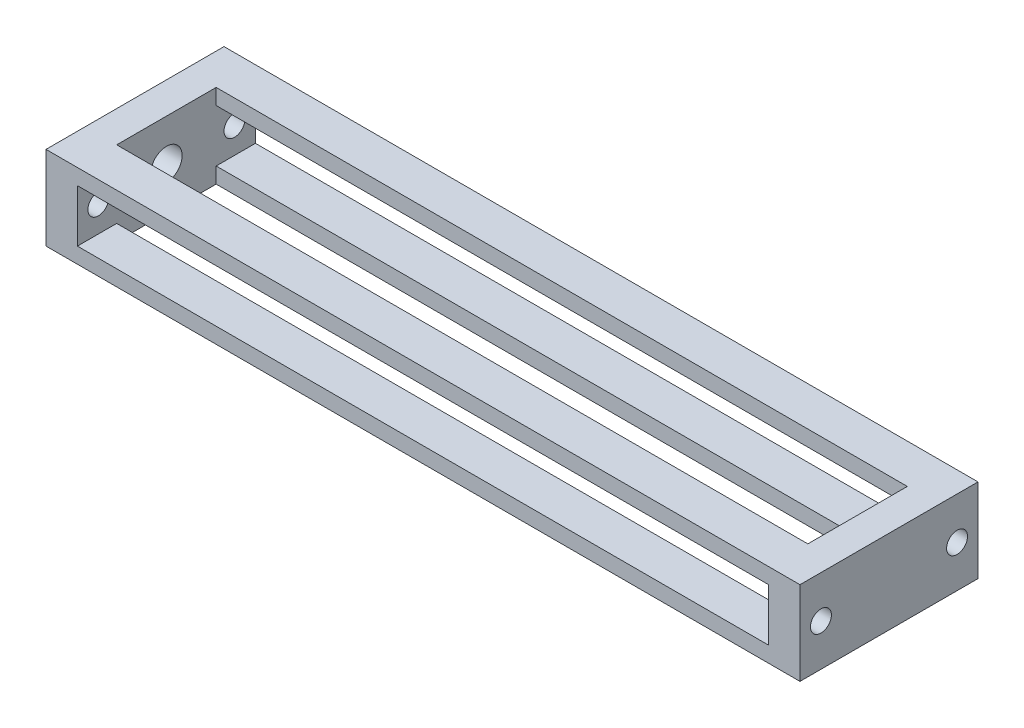
from build123d import *

# Parameters (mm, degrees)
SKETCH1_W               = 914.4
SKETCH1_H               = 215.9
BOSS_EXTRUDE1_DEPTH     = 101.6
CUT_EXTRUDE1_REACH      = 482.633
SKETCH2_W               = 838.2
SKETCH2_H               = 120.65
CUT_EXTRUDE2_DEPTH      = 516.720088808
CUT_EXTRUDE2_DEPTH_BACK = 516.720088808
SKETCH3_W               = 838.2
SKETCH3_H               = 63.5
CUT_EXTRUDE3_DEPTH      = 927.33855717
CUT_EXTRUDE3_DEPTH_BACK = 927.33855717
SKETCH4_R               = 12.7
CUT_EXTRUDE4_REACH      = 928.339
SKETCH5_R               = 19.05


with BuildPart() as part:
    # Sketch1 → Boss-Extrude1 (new body)
    with BuildSketch(Plane(origin=(0, 0, 0), x_dir=(1, 0, 0), z_dir=(0, 1, 0))):
        Rectangle(SKETCH1_W, SKETCH1_H)
    extrude(amount=BOSS_EXTRUDE1_DEPTH)

    # Sketch2 → Cut-Extrude1 (cut, up to next)
    with BuildSketch(Plane(origin=(0, 101.6, 0), x_dir=(1, 0, 0), z_dir=(0, 1, 0)), mode=Mode.PRIVATE) as cut_extrude1_sk1:
        Rectangle(SKETCH2_W, SKETCH2_H)
    cut_extrude1_tool1 = extrude(cut_extrude1_sk1.sketch, amount=-CUT_EXTRUDE1_REACH, mode=Mode.PRIVATE) & part.part
    add(cut_extrude1_tool1.solids().sort_by_distance((0, 101.6, 0))[0], mode=Mode.SUBTRACT)

    # Sketch3 → Cut-Extrude2 (cut, two sides: drawn at the far end of the back side and taken through both)
    with BuildSketch(Plane.XY.offset(107.95).offset(-CUT_EXTRUDE2_DEPTH_BACK)):
        with Locations((0, 50.8)):
            Rectangle(SKETCH3_W, SKETCH3_H)
    extrude(amount=CUT_EXTRUDE2_DEPTH + CUT_EXTRUDE2_DEPTH_BACK, mode=Mode.SUBTRACT)

    # Sketch4 → Cut-Extrude3 (cut, two sides: drawn at the far end of the back side and taken through both)
    with BuildSketch(Plane.ZY.offset(457.2).offset(-CUT_EXTRUDE3_DEPTH_BACK)):
        with Locations((82.55, 50.8)):
            Circle(SKETCH4_R)
        with Locations((-82.55, 50.8)):
            Circle(SKETCH4_R)
    extrude(amount=CUT_EXTRUDE3_DEPTH + CUT_EXTRUDE3_DEPTH_BACK, mode=Mode.SUBTRACT)

    # Sketch5 → Cut-Extrude4 (cut, up to next)
    with BuildSketch(Plane.ZY.offset(457.2), mode=Mode.PRIVATE) as cut_extrude4_sk1:
        with Locations((0, 50.8)):
            Circle(SKETCH5_R)
    cut_extrude4_tool1 = extrude(cut_extrude4_sk1.sketch, amount=-CUT_EXTRUDE4_REACH, mode=Mode.PRIVATE) & part.part
    add(cut_extrude4_tool1.solids().sort_by_distance((-457.2, 50.8, 0))[0], mode=Mode.SUBTRACT)


solid = part.part
